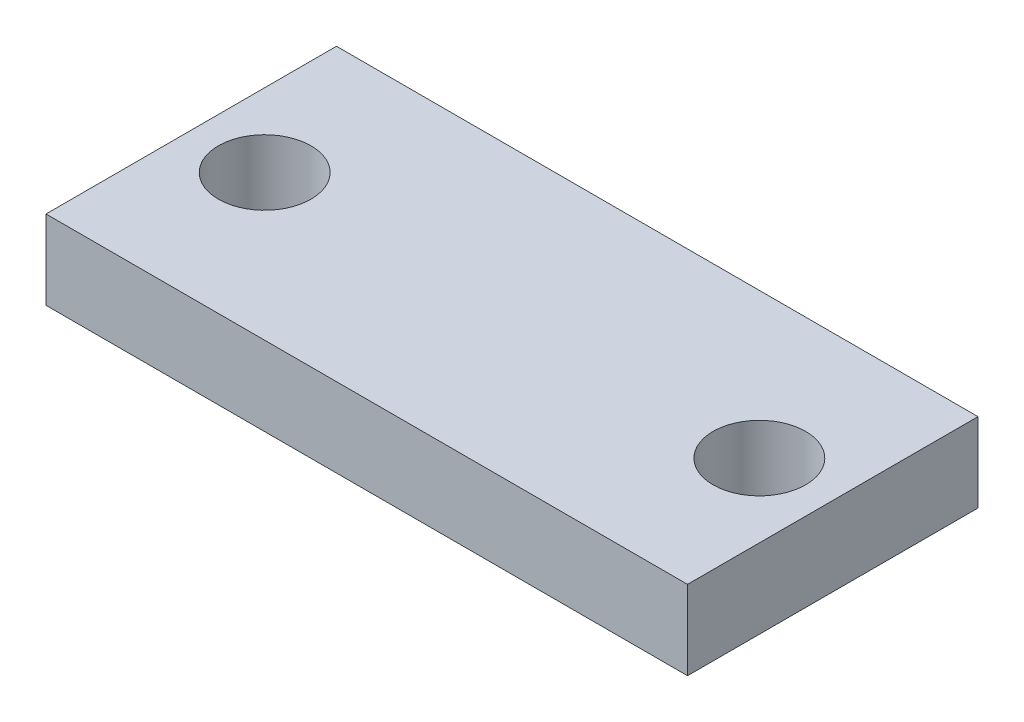
from build123d import *

# Parameters (mm, degrees)
SKETCH_1_W          = 32.42
SKETCH_1_H          = 14.68
EXTRUDE_1_DEPTH     = 4
SKETCH_2_R          = 2.34
CUT_EXTRUDE_1_DEPTH = 19.23841276


with BuildPart() as part:
    # 草图1 → 凸台-拉伸1 (new body)
    with BuildSketch(Plane(origin=(0, 0, 0), x_dir=(1, 0, 0), z_dir=(0, 1, 0))):
        Rectangle(SKETCH_1_W, SKETCH_1_H)
    extrude(amount=EXTRUDE_1_DEPTH)

    # 草图2 → 切除-拉伸1 (cut, through all)
    with BuildSketch(Plane(origin=(0, 4, 0), x_dir=(1, 0, 0), z_dir=(0, 1, 0))):
        with Locations(Location((12.5, 0, 0), (0, 0, 270))):
            Circle(SKETCH_2_R)
        with Locations(Location((-12.5, 0, 0), (0, 0, 270))):
            Circle(SKETCH_2_R)
    extrude(amount=-CUT_EXTRUDE_1_DEPTH, mode=Mode.SUBTRACT)


solid = part.part
